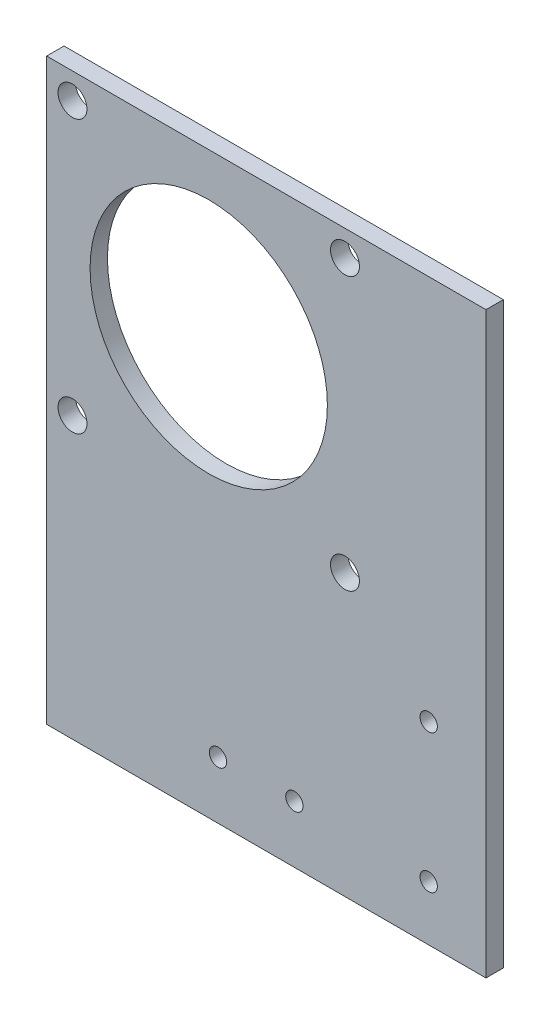
from build123d import *

# Parameters (mm, degrees)
SKETCH1_W           = 75.9
SKETCH1_H           = 100
BOSS_EXTRUDE1_DEPTH = 3
SKETCH2_R           = 2.5
CUT_EXTRUDE1_DEPTH  = 10
SKETCH5_R           = 1.5
CUT_EXTRUDE2_DEPTH  = 10
SKETCH7_R           = 1.5
CUT_EXTRUDE3_DEPTH  = 19.8
SKETCH8_R           = 20.5
CUT_EXTRUDE4_DEPTH  = 19.8


with BuildPart() as part:
    # Sketch1 → Boss-Extrude1 (new body)
    with BuildSketch(Plane.XY):
        with Locations((37.95, 50)):
            Rectangle(SKETCH1_W, SKETCH1_H)
    extrude(amount=BOSS_EXTRUDE1_DEPTH)

    # Sketch2 → Cut-Extrude1 (cut)
    with BuildSketch(Plane(origin=(0, 0, 0), x_dir=(-1, 0, 0), z_dir=(0, 0, -1))):
        with Locations((-51.538582233, 95.538582233)):
            Circle(SKETCH2_R)
        with Locations((-4.461417767, 95.538582233)):
            Circle(SKETCH2_R)
        with Locations((-4.461417767, 48.461417767)):
            Circle(SKETCH2_R)
        with Locations((-51.538582233, 48.461417767)):
            Circle(SKETCH2_R)
    extrude(amount=-CUT_EXTRUDE1_DEPTH, mode=Mode.SUBTRACT)

    # Sketch5 → Cut-Extrude2 (cut)
    with BuildSketch(Plane.XY.offset(3)):
        with Locations((66, 33.391370051)):
            Circle(SKETCH5_R)
        with Locations((66, 9.470993714)):
            Circle(SKETCH5_R)
    extrude(amount=-CUT_EXTRUDE2_DEPTH, mode=Mode.SUBTRACT)

    # Sketch7 → Cut-Extrude3 (cut)
    with BuildSketch(Plane(origin=(0, 0, 0), x_dir=(-1, 0, 0), z_dir=(0, 0, -1))):
        with Locations((-29.6, 9.9)):
            Circle(SKETCH7_R)
        with Locations((-42.8, 9.9)):
            Circle(SKETCH7_R)
    extrude(amount=-CUT_EXTRUDE3_DEPTH, mode=Mode.SUBTRACT)

    # Sketch8 → Cut-Extrude4 (cut)
    with BuildSketch(Plane(origin=(0, 0, 0), x_dir=(-1, 0, 0), z_dir=(0, 0, -1))):
        with Locations((-28, 72)):
            Circle(SKETCH8_R)
    extrude(amount=-CUT_EXTRUDE4_DEPTH, mode=Mode.SUBTRACT)


solid = part.part
